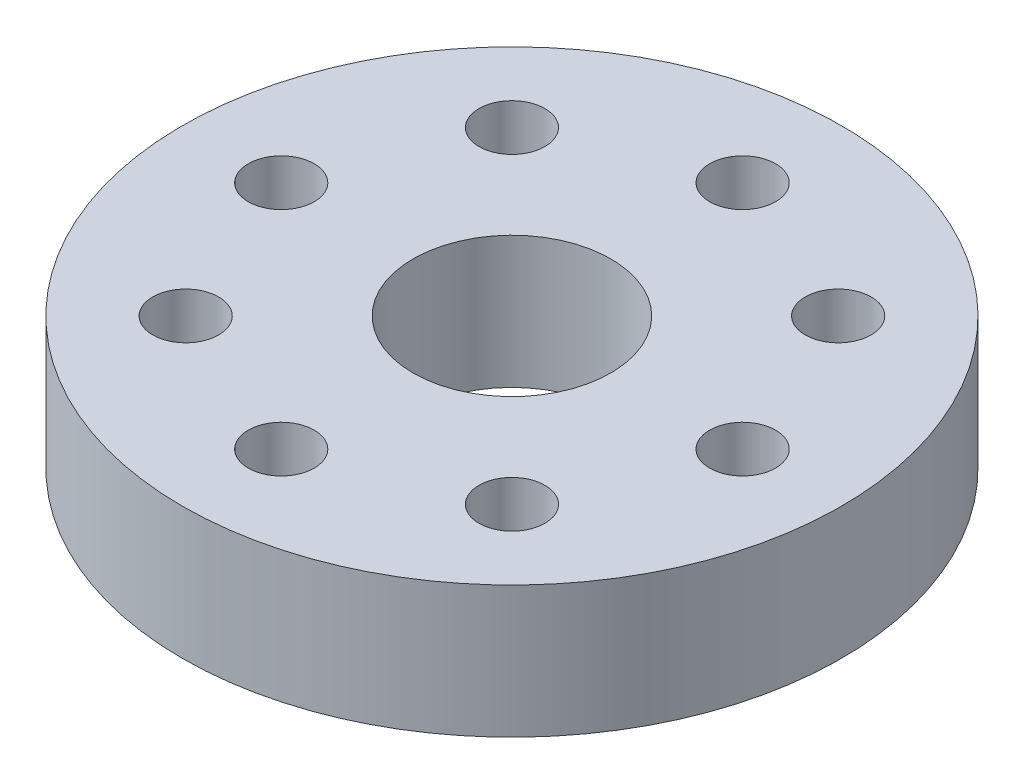
from build123d import *

# Parameters (mm, degrees)
SKETCH2_R           = 10
SKETCH2_R_2         = 3
SKETCH2_R_3         = 1
BOSS_EXTRUDE1_DEPTH = 4


with BuildPart() as part:
    # Sketch2 → Boss-Extrude1 (new body)
    with BuildSketch(Plane(origin=(0, 0, 0), x_dir=(1, 0, 0), z_dir=(0, 1, 0))):
        with Locations(Location((0, 0, 0), (0, 0, 270))):
            Circle(SKETCH2_R)
        with Locations(Location((0, 0, 0), (0, 0, 270))):
            Circle(SKETCH2_R_2, mode=Mode.SUBTRACT)
        with Locations(Location((0, 7, 0), (0, 0, 270))):
            Circle(SKETCH2_R_3, mode=Mode.SUBTRACT)
        with Locations(Location((4.949747468, 4.949747468, 0), (0, 0, 270))):
            Circle(SKETCH2_R_3, mode=Mode.SUBTRACT)
        with Locations(Location((7, 0, 0), (0, 0, 270))):
            Circle(SKETCH2_R_3, mode=Mode.SUBTRACT)
        with Locations(Location((4.949747468, -4.949747468, 0), (0, 0, 270))):
            Circle(SKETCH2_R_3, mode=Mode.SUBTRACT)
        with Locations(Location((0, -7, 0), (0, 0, 270))):
            Circle(SKETCH2_R_3, mode=Mode.SUBTRACT)
        with Locations(Location((-4.949747468, -4.949747468, 0), (0, 0, 270))):
            Circle(SKETCH2_R_3, mode=Mode.SUBTRACT)
        with Locations(Location((-7, 0, 0), (0, 0, 270))):
            Circle(SKETCH2_R_3, mode=Mode.SUBTRACT)
        with Locations(Location((-4.949747468, 4.949747468, 0), (0, 0, 270))):
            Circle(SKETCH2_R_3, mode=Mode.SUBTRACT)
    extrude(amount=BOSS_EXTRUDE1_DEPTH)


solid = part.part
